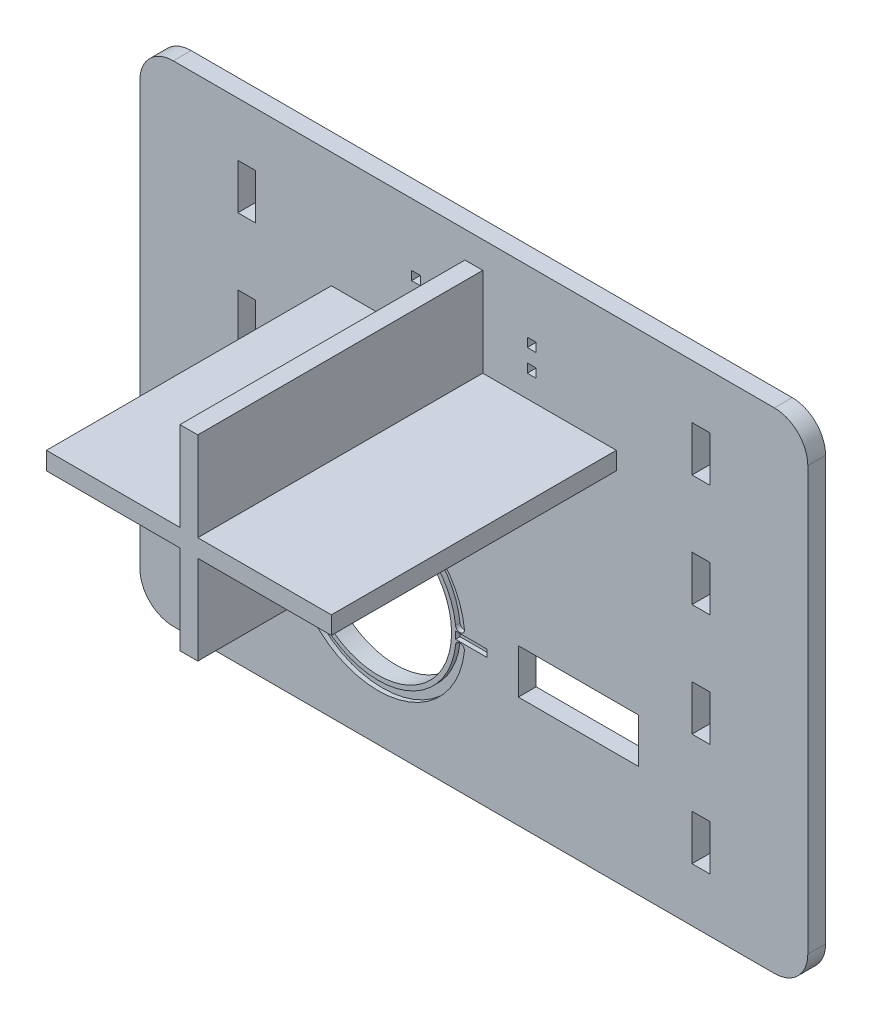
from build123d import *

# Parameters (mm, degrees)
SALIENTE_EXTRUIR1_DEPTH = 4
CROQUIS2_R              = 16.5
CROQUIS2_W              = 27
CROQUIS2_H              = 10
CORTAR_EXTRUIR1_DEPTH   = 4
SALIENTE_EXTRUIR2_DEPTH = 64
CORTAR_EXTRUIR2_REACH   = 200.05
CROQUIS5_W              = 4
CROQUIS5_H              = 10.2
CROQUIS5_W_2            = 2
CROQUIS5_H_2            = 2
CROQUIS6_W              = 7
CROQUIS6_H              = 1.611721712
CORTAR_EXTRUIR3_DEPTH   = 1


with BuildPart() as part:
    # Croquis1 → Saliente-Extruir1 (new body)
    with BuildSketch(Plane.XY):
        with BuildLine():
            Line((7.5, 0), (142.5, 0))
            ThreePointArc((142.5, 0), (147.803300859, 2.196699141), (150, 7.5))
            Line((150, 7.5), (150, 102.5))
            ThreePointArc((150, 102.5), (147.803300859, 107.803300859), (142.5, 110))
            Line((142.5, 110), (7.5, 110))
            ThreePointArc((7.5, 110), (2.196699141, 107.803300859), (0, 102.5))
            Line((0, 102.5), (0, 7.5))
            ThreePointArc((0, 7.5), (2.196699141, 2.196699141), (7.5, 0))
        make_face()
    extrude(amount=SALIENTE_EXTRUIR1_DEPTH)

    # Croquis2 → Cortar-Extruir1 (cut)
    with BuildSketch(Plane.XY.offset(4)):
        with Locations((53.5, 30)):
            Circle(CROQUIS2_R)
        with Locations((98.5, 30)):
            Rectangle(CROQUIS2_W, CROQUIS2_H)
    extrude(amount=-CORTAR_EXTRUIR1_DEPTH, mode=Mode.SUBTRACT)

    # Croquis4 → Saliente-Extruir2 (add)
    with BuildSketch(Plane.XY.offset(4)):
        Polygon((73, 60), (73, 80), (43, 80), (43, 84), (73, 84), (73, 104), (77, 104), (77, 84), (107, 84), (107, 80), (77, 80), (77, 60), align=None)
    extrude(amount=SALIENTE_EXTRUIR2_DEPTH)

    # Croquis5 → Cortar-Extruir2 (cut, up to next)
    with BuildSketch(Plane(origin=(0, 0, 0), x_dir=(-1, 0, 0), z_dir=(0, 0, -1)), mode=Mode.PRIVATE) as cortar_extruir2_sk1:
        with Locations((-126, 67.6)):
            Rectangle(CROQUIS5_W, CROQUIS5_H)
    cortar_extruir2_tool1 = extrude(cortar_extruir2_sk1.sketch, amount=-CORTAR_EXTRUIR2_REACH, mode=Mode.PRIVATE) & part.part
    # Croquis5 → Cortar-Extruir2 (cut, up to next)
    with BuildSketch(Plane(origin=(0, 0, 0), x_dir=(-1, 0, 0), z_dir=(0, 0, -1)), mode=Mode.PRIVATE) as cortar_extruir2_sk2:
        with Locations((-126, 42.4)):
            Rectangle(CROQUIS5_W, CROQUIS5_H)
    cortar_extruir2_tool2 = extrude(cortar_extruir2_sk2.sketch, amount=-CORTAR_EXTRUIR2_REACH, mode=Mode.PRIVATE) & part.part
    # Croquis5 → Cortar-Extruir2 (cut, up to next)
    with BuildSketch(Plane(origin=(0, 0, 0), x_dir=(-1, 0, 0), z_dir=(0, 0, -1)), mode=Mode.PRIVATE) as cortar_extruir2_sk3:
        with Locations((-126, 17.2)):
            Rectangle(CROQUIS5_W, CROQUIS5_H)
    cortar_extruir2_tool3 = extrude(cortar_extruir2_sk3.sketch, amount=-CORTAR_EXTRUIR2_REACH, mode=Mode.PRIVATE) & part.part
    # Croquis5 → Cortar-Extruir2 (cut, up to next)
    with BuildSketch(Plane(origin=(0, 0, 0), x_dir=(-1, 0, 0), z_dir=(0, 0, -1)), mode=Mode.PRIVATE) as cortar_extruir2_sk4:
        with Locations((-126, 92.8)):
            Rectangle(CROQUIS5_W, CROQUIS5_H)
    cortar_extruir2_tool4 = extrude(cortar_extruir2_sk4.sketch, amount=-CORTAR_EXTRUIR2_REACH, mode=Mode.PRIVATE) & part.part
    # Croquis5 → Cortar-Extruir2 (cut, up to next)
    with BuildSketch(Plane(origin=(0, 0, 0), x_dir=(-1, 0, 0), z_dir=(0, 0, -1)), mode=Mode.PRIVATE) as cortar_extruir2_sk5:
        with Locations((-24, 92.8)):
            Rectangle(CROQUIS5_W, CROQUIS5_H)
    cortar_extruir2_tool5 = extrude(cortar_extruir2_sk5.sketch, amount=-CORTAR_EXTRUIR2_REACH, mode=Mode.PRIVATE) & part.part
    # Croquis5 → Cortar-Extruir2 (cut, up to next)
    with BuildSketch(Plane(origin=(0, 0, 0), x_dir=(-1, 0, 0), z_dir=(0, 0, -1)), mode=Mode.PRIVATE) as cortar_extruir2_sk6:
        with Locations((-24, 67.6)):
            Rectangle(CROQUIS5_W, CROQUIS5_H)
    cortar_extruir2_tool6 = extrude(cortar_extruir2_sk6.sketch, amount=-CORTAR_EXTRUIR2_REACH, mode=Mode.PRIVATE) & part.part
    # Croquis5 → Cortar-Extruir2 (cut, up to next)
    with BuildSketch(Plane(origin=(0, 0, 0), x_dir=(-1, 0, 0), z_dir=(0, 0, -1)), mode=Mode.PRIVATE) as cortar_extruir2_sk7:
        with Locations((-24, 42.4)):
            Rectangle(CROQUIS5_W, CROQUIS5_H)
    cortar_extruir2_tool7 = extrude(cortar_extruir2_sk7.sketch, amount=-CORTAR_EXTRUIR2_REACH, mode=Mode.PRIVATE) & part.part
    # Croquis5 → Cortar-Extruir2 (cut, up to next)
    with BuildSketch(Plane(origin=(0, 0, 0), x_dir=(-1, 0, 0), z_dir=(0, 0, -1)), mode=Mode.PRIVATE) as cortar_extruir2_sk8:
        with Locations((-24, 17.2)):
            Rectangle(CROQUIS5_W, CROQUIS5_H)
    cortar_extruir2_tool8 = extrude(cortar_extruir2_sk8.sketch, amount=-CORTAR_EXTRUIR2_REACH, mode=Mode.PRIVATE) & part.part
    # Croquis5 → Cortar-Extruir2 (cut, up to next)
    with BuildSketch(Plane(origin=(0, 0, 0), x_dir=(-1, 0, 0), z_dir=(0, 0, -1)), mode=Mode.PRIVATE) as cortar_extruir2_sk9:
        with Locations((-88, 95)):
            Rectangle(CROQUIS5_W_2, CROQUIS5_H_2)
    cortar_extruir2_tool9 = extrude(cortar_extruir2_sk9.sketch, amount=-CORTAR_EXTRUIR2_REACH, mode=Mode.PRIVATE) & part.part
    # Croquis5 → Cortar-Extruir2 (cut, up to next)
    with BuildSketch(Plane(origin=(0, 0, 0), x_dir=(-1, 0, 0), z_dir=(0, 0, -1)), mode=Mode.PRIVATE) as cortar_extruir2_sk10:
        with Locations((-88, 90)):
            Rectangle(CROQUIS5_W_2, CROQUIS5_H_2)
    cortar_extruir2_tool10 = extrude(cortar_extruir2_sk10.sketch, amount=-CORTAR_EXTRUIR2_REACH, mode=Mode.PRIVATE) & part.part
    # Croquis5 → Cortar-Extruir2 (cut, up to next)
    with BuildSketch(Plane(origin=(0, 0, 0), x_dir=(-1, 0, 0), z_dir=(0, 0, -1)), mode=Mode.PRIVATE) as cortar_extruir2_sk11:
        with Locations((-62, 90)):
            Rectangle(CROQUIS5_W_2, CROQUIS5_H_2)
    cortar_extruir2_tool11 = extrude(cortar_extruir2_sk11.sketch, amount=-CORTAR_EXTRUIR2_REACH, mode=Mode.PRIVATE) & part.part
    # Croquis5 → Cortar-Extruir2 (cut, up to next)
    with BuildSketch(Plane(origin=(0, 0, 0), x_dir=(-1, 0, 0), z_dir=(0, 0, -1)), mode=Mode.PRIVATE) as cortar_extruir2_sk12:
        with Locations((-62, 95)):
            Rectangle(CROQUIS5_W_2, CROQUIS5_H_2)
    cortar_extruir2_tool12 = extrude(cortar_extruir2_sk12.sketch, amount=-CORTAR_EXTRUIR2_REACH, mode=Mode.PRIVATE) & part.part
    # Croquis5 → Cortar-Extruir2 (cut, up to next)
    with BuildSketch(Plane(origin=(0, 0, 0), x_dir=(-1, 0, 0), z_dir=(0, 0, -1)), mode=Mode.PRIVATE) as cortar_extruir2_sk13:
        with Locations((-88, 74)):
            Rectangle(CROQUIS5_W_2, CROQUIS5_H_2)
    cortar_extruir2_tool13 = extrude(cortar_extruir2_sk13.sketch, amount=-CORTAR_EXTRUIR2_REACH, mode=Mode.PRIVATE) & part.part
    # Croquis5 → Cortar-Extruir2 (cut, up to next)
    with BuildSketch(Plane(origin=(0, 0, 0), x_dir=(-1, 0, 0), z_dir=(0, 0, -1)), mode=Mode.PRIVATE) as cortar_extruir2_sk14:
        with Locations((-88, 69)):
            Rectangle(CROQUIS5_W_2, CROQUIS5_H_2)
    cortar_extruir2_tool14 = extrude(cortar_extruir2_sk14.sketch, amount=-CORTAR_EXTRUIR2_REACH, mode=Mode.PRIVATE) & part.part
    # Croquis5 → Cortar-Extruir2 (cut, up to next)
    with BuildSketch(Plane(origin=(0, 0, 0), x_dir=(-1, 0, 0), z_dir=(0, 0, -1)), mode=Mode.PRIVATE) as cortar_extruir2_sk15:
        with Locations((-62, 69)):
            Rectangle(CROQUIS5_W_2, CROQUIS5_H_2)
    cortar_extruir2_tool15 = extrude(cortar_extruir2_sk15.sketch, amount=-CORTAR_EXTRUIR2_REACH, mode=Mode.PRIVATE) & part.part
    # Croquis5 → Cortar-Extruir2 (cut, up to next)
    with BuildSketch(Plane(origin=(0, 0, 0), x_dir=(-1, 0, 0), z_dir=(0, 0, -1)), mode=Mode.PRIVATE) as cortar_extruir2_sk16:
        with Locations((-62, 74)):
            Rectangle(CROQUIS5_W_2, CROQUIS5_H_2)
    cortar_extruir2_tool16 = extrude(cortar_extruir2_sk16.sketch, amount=-CORTAR_EXTRUIR2_REACH, mode=Mode.PRIVATE) & part.part
    add(cortar_extruir2_tool1.solids().sort_by_distance((126, 67.6, 0))[0], mode=Mode.SUBTRACT)
    add(cortar_extruir2_tool2.solids().sort_by_distance((126, 42.4, 0))[0], mode=Mode.SUBTRACT)
    add(cortar_extruir2_tool3.solids().sort_by_distance((126, 17.2, 0))[0], mode=Mode.SUBTRACT)
    add(cortar_extruir2_tool4.solids().sort_by_distance((126, 92.8, 0))[0], mode=Mode.SUBTRACT)
    add(cortar_extruir2_tool5.solids().sort_by_distance((24, 92.8, 0))[0], mode=Mode.SUBTRACT)
    add(cortar_extruir2_tool6.solids().sort_by_distance((24, 67.6, 0))[0], mode=Mode.SUBTRACT)
    add(cortar_extruir2_tool7.solids().sort_by_distance((24, 42.4, 0))[0], mode=Mode.SUBTRACT)
    add(cortar_extruir2_tool8.solids().sort_by_distance((24, 17.2, 0))[0], mode=Mode.SUBTRACT)
    add(cortar_extruir2_tool9.solids().sort_by_distance((88, 95, 0))[0], mode=Mode.SUBTRACT)
    add(cortar_extruir2_tool10.solids().sort_by_distance((88, 90, 0))[0], mode=Mode.SUBTRACT)
    add(cortar_extruir2_tool11.solids().sort_by_distance((62, 90, 0))[0], mode=Mode.SUBTRACT)
    add(cortar_extruir2_tool12.solids().sort_by_distance((62, 95, 0))[0], mode=Mode.SUBTRACT)
    add(cortar_extruir2_tool13.solids().sort_by_distance((88, 74, 0))[0], mode=Mode.SUBTRACT)
    add(cortar_extruir2_tool14.solids().sort_by_distance((88, 69, 0))[0], mode=Mode.SUBTRACT)
    add(cortar_extruir2_tool15.solids().sort_by_distance((62, 69, 0))[0], mode=Mode.SUBTRACT)
    add(cortar_extruir2_tool16.solids().sort_by_distance((62, 74, 0))[0], mode=Mode.SUBTRACT)

    # Croquis6 → Cortar-Extruir3 (cut)
    with BuildSketch(Plane.XY.offset(4)):
        with Locations((74.4, 30)):
            Rectangle(CROQUIS6_W, CROQUIS6_H)
        with Locations((32.6, 30)):
            Rectangle(CROQUIS6_W, CROQUIS6_H)
        with BuildLine():
            ThreePointArc((72.885713301, 32.108108108), (53.5, 49.5), (34.114286699, 32.108108108))
            ThreePointArc((34.114286699, 32.108108108), (35.000317734, 31.005860856), (36.102564986, 31.891891892))
            ThreePointArc((36.102564986, 31.891891892), (53.5, 47.5), (70.897435014, 31.891891892))
            ThreePointArc((70.897435014, 31.891891892), (71.999682266, 31.005860856), (72.885713301, 32.108108108))
        make_face()
        with BuildLine():
            ThreePointArc((72.885713301, 27.891891892), (53.5, 10.5), (34.114286699, 27.891891892))
            ThreePointArc((34.114286699, 27.891891892), (35.000317734, 28.994139144), (36.102564986, 28.108108108))
            ThreePointArc((36.102564986, 28.108108108), (53.5, 12.5), (70.897435014, 28.108108108))
            ThreePointArc((70.897435014, 28.108108108), (71.999682266, 28.994139144), (72.885713301, 27.891891892))
        make_face()
    cortar_extruir3 = extrude(amount=-CORTAR_EXTRUIR3_DEPTH, mode=Mode.SUBTRACT)

    # Simetría1: Cortar-Extruir3 across plane
    add(cortar_extruir3.mirror(Plane.XY.offset(2)), mode=Mode.SUBTRACT)


solid = part.part
